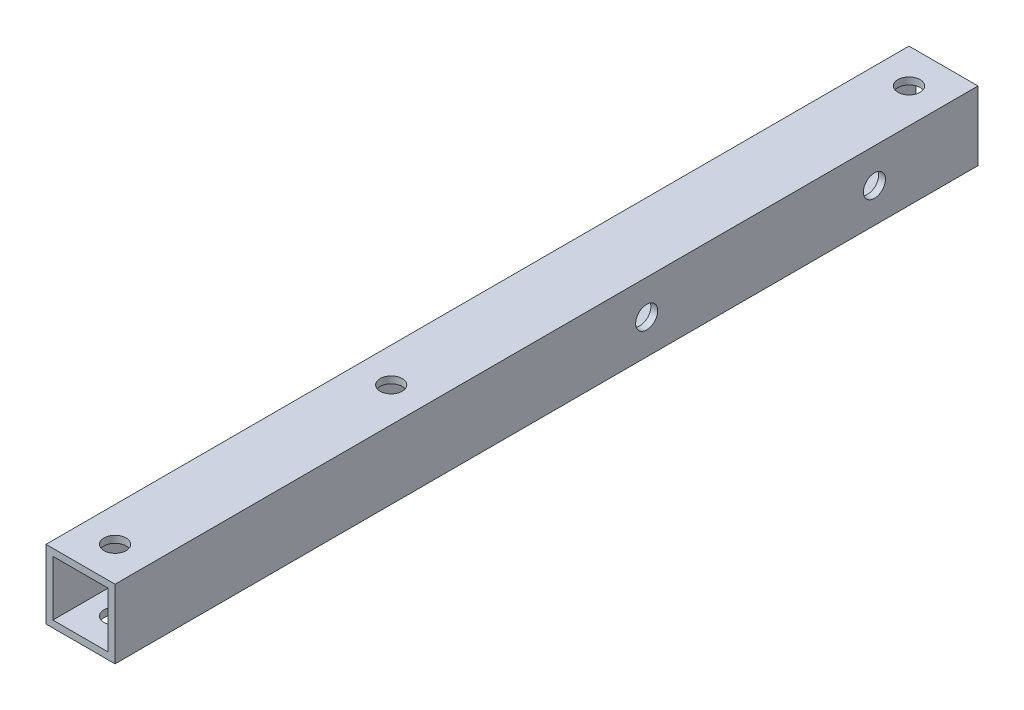
from build123d import *

# Parameters (mm, degrees)
SKETCH_1_W          = 10
SKETCH_1_H          = 10
SKETCH_1_W_2        = 8
SKETCH_1_H_2        = 8
EXTRUDE_1_DEPTH     = 125
SKETCH_2_R          = 1.6
CUT_EXTRUDE_1_DEPTH = 126.49900398
SKETCH_3_R          = 1.6
CUT_EXTRUDE_2_DEPTH = 126.49900398
SKETCH_4_R          = 1.6
CUT_EXTRUDE_3_DEPTH = 126.49900398


with BuildPart() as part:
    # ｽｹｯﾁ1 → ﾎﾞｽ - 押し出し1 (new body)
    with BuildSketch(Plane.XY):
        Rectangle(SKETCH_1_W, SKETCH_1_H)
        Rectangle(SKETCH_1_W_2, SKETCH_1_H_2, mode=Mode.SUBTRACT)
    extrude(amount=EXTRUDE_1_DEPTH)

    # ｽｹｯﾁ2 → ｶｯﾄ - 押し出し1 (cut, through all)
    with BuildSketch(Plane.XZ.offset(5)):
        with Locations(Location((0, 5, 0), (0, 0, 270))):
            Circle(SKETCH_2_R)
        with Locations(Location((0, 80, 0), (0, 0, 270))):
            Circle(SKETCH_2_R)
        with Locations(Location((0, 120, 0), (0, 0, 270))):
            Circle(SKETCH_2_R)
    extrude(amount=-CUT_EXTRUDE_1_DEPTH, mode=Mode.SUBTRACT)

    # ｽｹｯﾁ3 → ｶｯﾄ - 押し出し2 (cut, through all)
    with BuildSketch(Plane(origin=(5, 0, 0), x_dir=(0, 0, -1), z_dir=(1, 0, 0))):
        with Locations(Location((-15, 0, 0), (0, 0, 90))):
            Circle(SKETCH_3_R)
    extrude(amount=-CUT_EXTRUDE_2_DEPTH, mode=Mode.SUBTRACT)

    # ｽｹｯﾁ4 → ｶｯﾄ - 押し出し3 (cut, through all)
    with BuildSketch(Plane(origin=(5, 0, 0), x_dir=(0, 0, -1), z_dir=(1, 0, 0))):
        with Locations(Location((-47.989898732, 0, 0), (0, 0, 90))):
            Circle(SKETCH_4_R)
    extrude(amount=-CUT_EXTRUDE_3_DEPTH, mode=Mode.SUBTRACT)


solid = part.part
